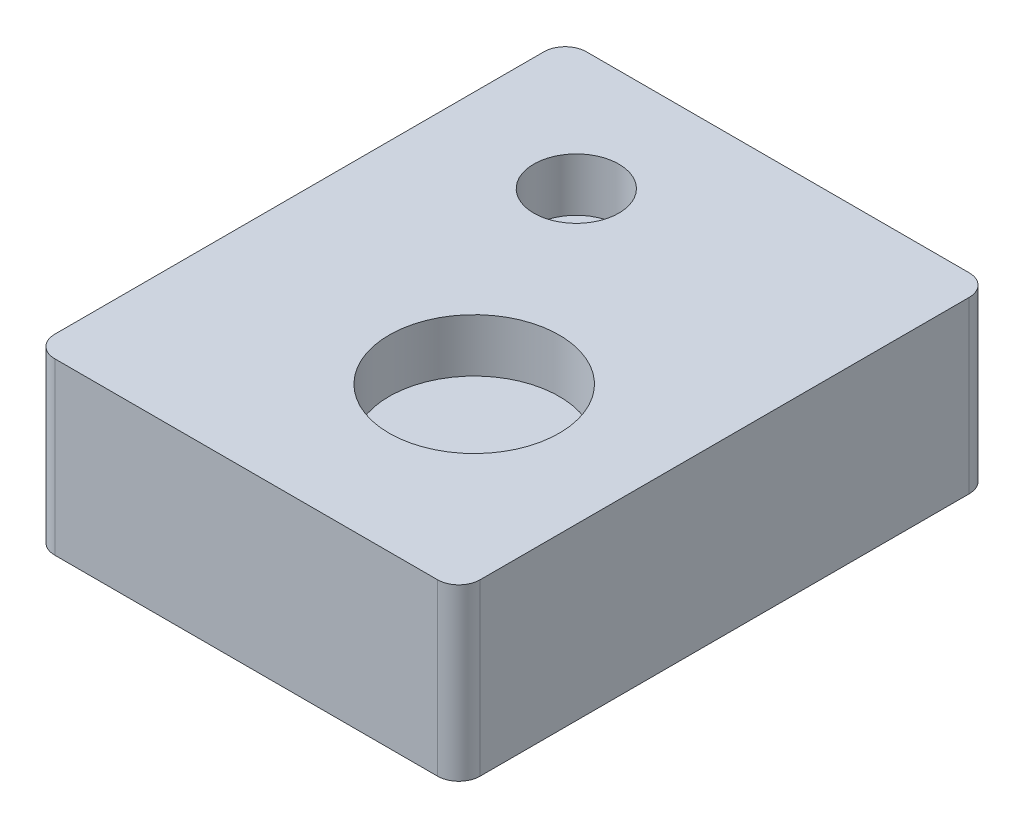
from build123d import *

# Parameters (mm, degrees)
SKETCH1_W           = 20
SKETCH1_H           = 25
BOSS_EXTRUDE1_DEPTH = 8
FILLET1_R           = 1
SKETCH4_R           = 2
SKETCH4_R_2         = 4
CUT_EXTRUDE1_DEPTH  = 2.5


with BuildPart() as part:
    # Sketch1 → Boss-Extrude1 (new body)
    with BuildSketch(Plane(origin=(0, 0, 0), x_dir=(1, 0, 0), z_dir=(0, 1, 0))):
        with Locations((1.861702128, -5.053191489)):
            Rectangle(SKETCH1_W, SKETCH1_H)
    extrude(amount=BOSS_EXTRUDE1_DEPTH)

    # Fillet1
    fillet1_edges = [part.edges().sort_by_distance(p)[0] for p in [
        (-8.138297872, 4, -7.446808511),
        (-8.138297872, 4, 17.553191489),
        (11.861702128, 4, 17.553191489),
        (11.861702128, 4, -7.446808511),
    ]]
    fillet(fillet1_edges, radius=FILLET1_R)

    # Sketch4 → Cut-Extrude1 (cut)
    with BuildSketch(Plane(origin=(0, 8, 0), x_dir=(1, 0, 0), z_dir=(0, 1, 0))):
        with Locations(Location((-1.804003479, 1.636713319, 0), (0, 0, 270))):
            Circle(SKETCH4_R)
        with Locations(Location((3.755918293, -8.724959073, 0), (0, 0, 270))):
            Circle(SKETCH4_R_2)
    extrude(amount=-CUT_EXTRUDE1_DEPTH, mode=Mode.SUBTRACT)


solid = part.part
